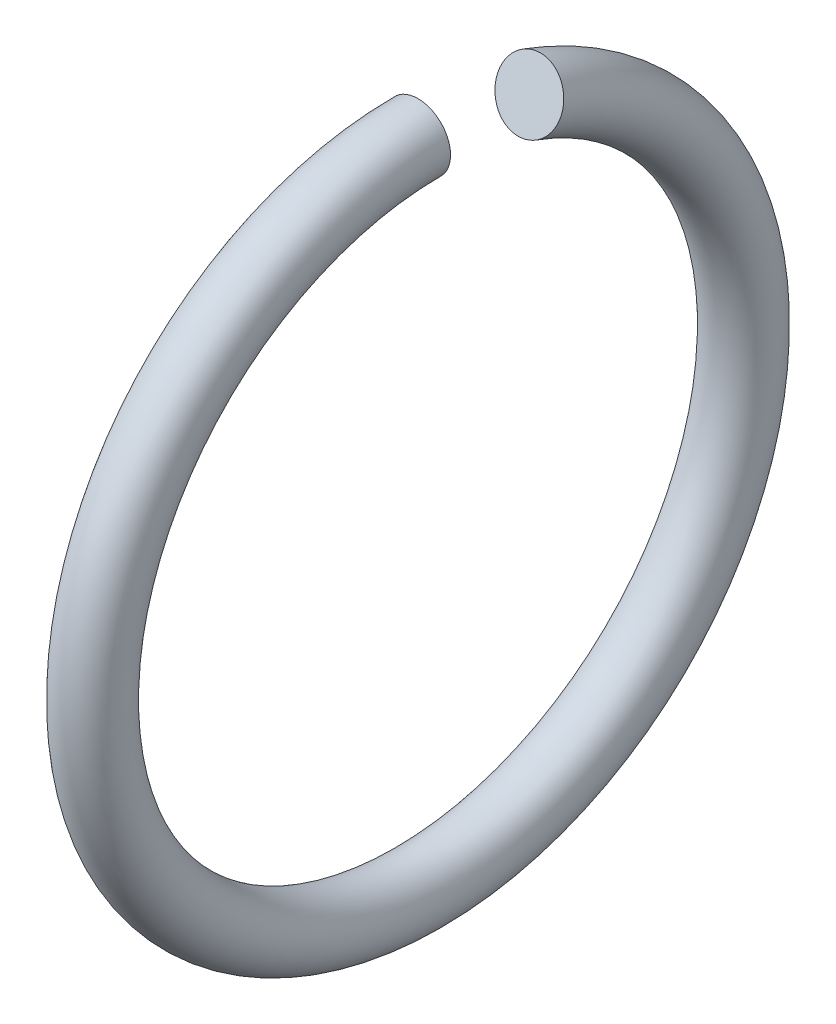
from build123d import *

# Parameters (mm, degrees)
ESQUISSE1_R       = 1.5
R_VOLUTION1_ANGLE = 340


with BuildPart() as part:
    # Esquisse1 → Révolution1 (revolve)
    with BuildSketch(Plane.XY):
        with Locations((0, 15)):
            Circle(ESQUISSE1_R)
    revolve(axis=Axis((-15.77032967, 0, 0), (1, 0, 0)), revolution_arc=R_VOLUTION1_ANGLE)


solid = part.part
